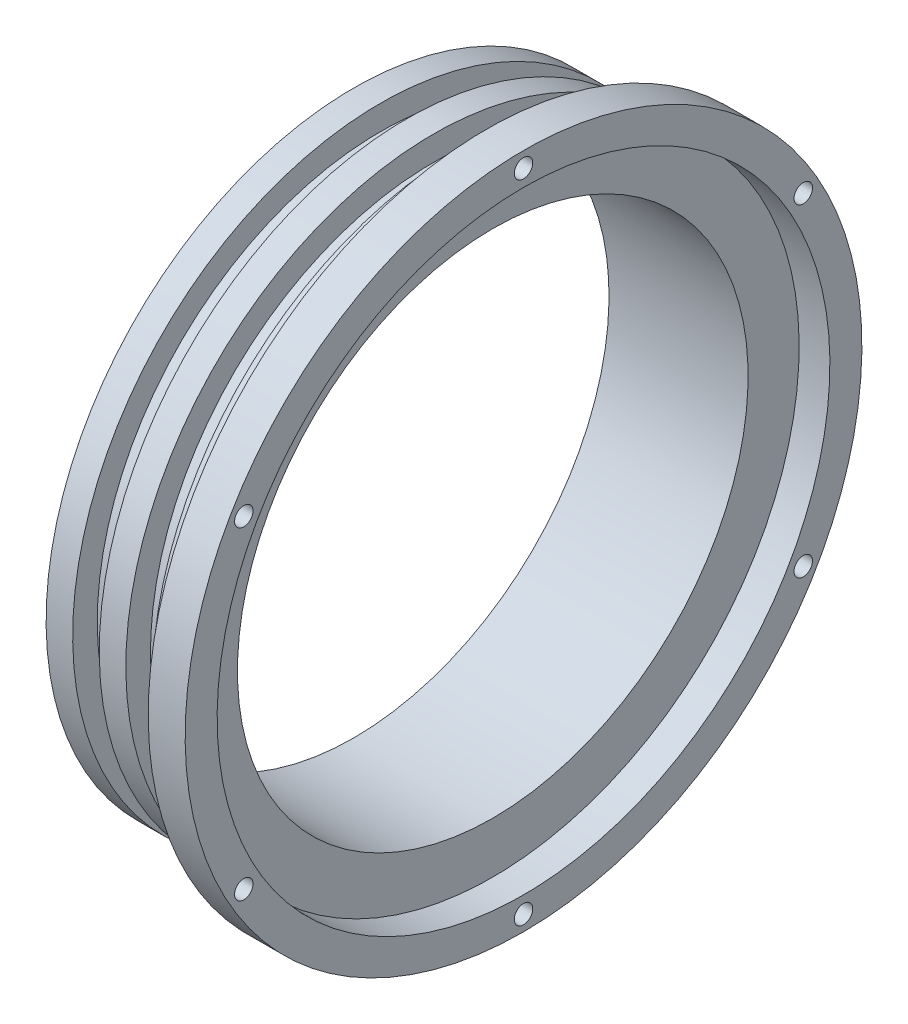
from build123d import *

# Parameters (mm, degrees)
SKETCH_2_R               = 1.5
CUT_EXTRUDE_1_DEPTH      = 6
PATTERN_CIRCULAR_1_COUNT = 6
SKETCH_3_R               = 1.5
CUT_EXTRUDE_2_DEPTH      = 81.725212914
PATTERN_CIRCULAR_2_COUNT = 6
SKETCH_4_R               = 49.8
CUT_EXTRUDE_3_DEPTH      = 5


with BuildPart() as part:
    # 草图1 → 旋转1 (revolve)
    with BuildSketch(Plane.XY, mode=Mode.PRIVATE) as revolve_1_sk:
        Polygon((0, 41.5), (0, 50), (4.32, 50), (4.32, 46), (8.64, 46), (8.64, 50), (12.96, 50), (12.96, 46), (17.28, 46), (17.28, 50), (21.6, 50), (21.6, 55), (27.6, 55), (27.6, 41.5), align=None)
    revolve(revolve_1_sk.sketch.rotate(Axis((27.6, 0, 0), (1, 0, 0)), 180), axis=Axis((27.6, 0, 0), (1, 0, 0)))

    # 草图2 → 切除-拉伸1 (cut)
    with BuildSketch(Plane.ZY):
        with Locations(Location((0, 44, 0), (0, 0, 270))):
            Circle(SKETCH_2_R)
    cut_extrude_1 = extrude(amount=-CUT_EXTRUDE_1_DEPTH, mode=Mode.SUBTRACT)

    # 阵列(圆周)1: 切除-拉伸1 ×6 about axis
    pattern_circular_1_axis = Axis((0, 0, 0), (1, 0, 0))
    for i in range(1, PATTERN_CIRCULAR_1_COUNT):
        add(cut_extrude_1.rotate(pattern_circular_1_axis, i * 360 / PATTERN_CIRCULAR_1_COUNT), mode=Mode.SUBTRACT)

    # 草图3 → 切除-拉伸2 (cut, symmetric)
    with BuildSketch(Plane.ZY.offset(-21.6)):
        with Locations((0, 52.5)):
            Circle(SKETCH_3_R)
    cut_extrude_2 = extrude(amount=CUT_EXTRUDE_2_DEPTH, both=True, mode=Mode.SUBTRACT)

    # 阵列(圆周)2: 切除-拉伸2 ×6 about axis
    pattern_circular_2_axis = Axis((0, 0, 0), (1, 0, 0))
    for i in range(1, PATTERN_CIRCULAR_2_COUNT):
        add(cut_extrude_2.rotate(pattern_circular_2_axis, i * 360 / PATTERN_CIRCULAR_2_COUNT), mode=Mode.SUBTRACT)

    # 草图4 → 切除-拉伸3 (cut)
    with BuildSketch(Plane(origin=(27.6, 0, 0), x_dir=(0, 0, -1), z_dir=(1, 0, 0))):
        with Locations(Location((0, 0, 0), (0, 0, 90))):
            Circle(SKETCH_4_R)
    extrude(amount=-CUT_EXTRUDE_3_DEPTH, mode=Mode.SUBTRACT)


solid = part.part
